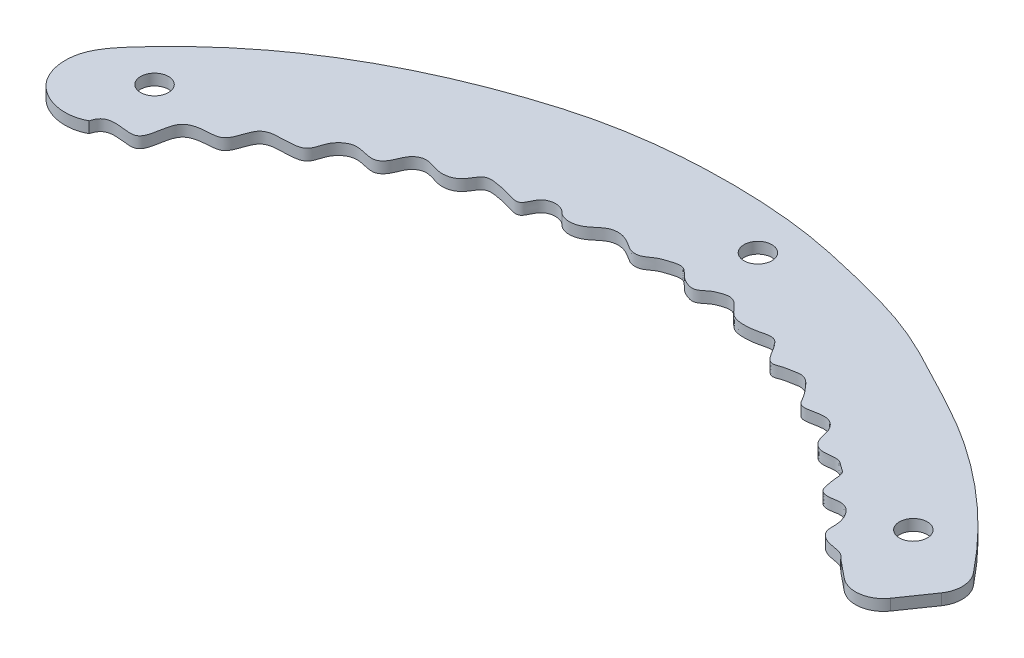
from build123d import *

# Parameters (mm, degrees)
SKETCH_1_R      = 1.5
EXTRUDE_1_DEPTH = 1.2


with BuildPart() as part:
    # 草图1 → 凸台-拉伸1 (new body)
    with BuildSketch(Plane(origin=(0, 0, 0), x_dir=(1, 0, 0), z_dir=(0, 1, 0))):
        with BuildLine():
            Line((1.554842025, -8.337470752), (-0.430182488, -6.721253648))
            add(Edge.make_bspline(
                [(-12.167013089, 2.582495486), (-11.447119164, 1.921340953), (-10.022984841, 2.808187734), (-8.976354657, 1.809108801), (-8.213499094, 1.403974471), (-8.200391236, 0.349911537), (-8.042555918, -0.493978579), (-7.818959944, -1.429413296), (-6.816890722, -1.753533483), (-5.863601288, -1.34252738), (-4.741281829, -1.710962858), (-4.08275959, -2.621388779), (-3.79245167, -3.751248723), (-3.91045161, -4.869308905), (-3.232112336, -5.62677615), (-2.206661316, -6.030432082), (-1.046114317, -6.062557348), (-0.554897819, -6.564537203), (-0.430182488, -6.721253648)],
                knots=[0, 0, 0, 0, 0.036097754, 0.047992692, 0.058181774, 0.069734768, 0.087708592, 0.096698401, 0.107023851, 0.126400839, 0.138602891, 0.153227265, 0.171393147, 0.187122158, 0.197485969, 0.211171774, 0.233173167, 0.241577569, 0.241577569, 0.241577569, 0.241577569], degree=3))
            add(Edge.make_bspline(
                [(-23.910622578, 9.605703978), (-23.558251314, 9.383041776), (-22.85001025, 7.300114936), (-21.469099437, 8.026620732), (-20.587576459, 8.115237732), (-19.709548371, 8.393102022), (-18.887373608, 8.016971733), (-18.216370279, 7.270572104), (-17.540916668, 6.495384207), (-16.917331111, 5.169819241), (-15.366310155, 5.588705202), (-13.906745135, 5.747852304), (-12.700950999, 4.350101993), (-12.869807319, 3.109436312), (-12.167013089, 2.582495486)],
                knots=[0, 0, 0, 0, 0.161236225, 0.212348344, 0.265446348, 0.336192936, 0.378687986, 0.430636784, 0.526782428, 0.58317029, 0.682556587, 0.781270878, 0.853713789, 1, 1, 1, 1], degree=3))
            add(Edge.make_bspline(
                [(-47.71500508, 10.605110168), (-47.069012481, 9.900665068), (-45.139196949, 9.95795741), (-43.921975491, 11.586374146), (-42.400721003, 11.771016568), (-41.337482007, 11.307681084), (-40.40808197, 10.571392493), (-39.243263098, 10.605948191), (-38.4214004, 11.389817674), (-37.304125392, 11.739033216), (-35.960015429, 12.177678326), (-35.169730239, 11.095889884), (-34.309116257, 10.597574945), (-33.230198284, 10.326758803), (-32.483614479, 11.172498611), (-31.555931442, 11.556931314), (-30.496219104, 11.833170836), (-29.544579211, 11.011421042), (-28.764862011, 9.931048883), (-27.275040054, 9.791587696), (-25.67786866, 9.995507673), (-24.429632089, 10.493743868), (-23.910622578, 9.605703978)],
                knots=[0, 0, 0, 0, 0.101433113, 0.182304189, 0.213922123, 0.268056796, 0.309965909, 0.34593792, 0.389140378, 0.432998877, 0.482664358, 0.529097115, 0.56671955, 0.598853252, 0.644172777, 0.680167064, 0.715860802, 0.759457234, 0.81099574, 0.863337515, 0.916048189, 1, 1, 1, 1], degree=3))
            add(Edge.make_bspline(
                [(-81.542178077, -6.351268144), (-81.044844843, -4.213625321), (-76.423345521, -7.044199198), (-77.193888837, -1.434611804), (-74.499558051, -1.007137962), (-72.119579546, -0.982023336), (-72.013913214, 2.531930358), (-69.193446107, 2.27076818), (-66.979018583, 2.576834428), (-66.793337265, 4.561491582), (-65.228171966, 5.86647802), (-63.704347585, 5.431207109), (-62.480661462, 5.233397848), (-61.483715157, 6.199125284), (-61.300552849, 7.503159562), (-59.783145719, 8.397586745), (-58.519758063, 7.703062295), (-57.095970203, 7.658840879), (-55.836025853, 8.294649296), (-55.32460036, 9.901269354), (-53.585326171, 9.702085323), (-52.400209447, 9.422945796), (-50.584393612, 8.813116301), (-50.168047343, 11.113872633), (-48.335164825, 11.166138113), (-47.71500508, 10.605110168)],
                knots=[0, 0, 0, 0, 0.100331873, 0.186040252, 0.234954161, 0.270300487, 0.337741822, 0.40191981, 0.438279808, 0.476829941, 0.523229195, 0.559516768, 0.58417291, 0.604077361, 0.648703103, 0.670042471, 0.715950186, 0.738312734, 0.768610762, 0.808997733, 0.834826144, 0.87587524, 0.906400305, 0.9417144, 1, 1, 1, 1], degree=3))
            add(Edge.make_bspline(
                [(-4.574887638, 10.66290641), (-7.047776333, 12.318799851), (-11.472376922, 14.618164059), (-18.644622628, 18.44627649), (-25.552826118, 20.285346034), (-32.311147255, 21.765124491), (-38.45622276, 22.334485332), (-46.036730806, 22.337974028), (-53.580560852, 21.321427277), (-60.391912278, 19.259553222), (-67.916492846, 16.400566872), (-77.044091587, 11.490220125), (-84.229889169, 5.096115142), (-88.471829307, 0.104808879), (-88.546333927, -3.099341055), (-86.895953255, -6.534699066), (-83.496346554, -7.409474397), (-81.542178077, -6.351268144)],
                knots=[0.083499365, 0.083499365, 0.083499365, 0.083499365, 0.162308773, 0.214040795, 0.297345888, 0.349154488, 0.396314503, 0.459530434, 0.548645129, 0.595484357, 0.646703325, 0.76081959, 0.864658636, 0.902713076, 0.926128156, 0.944546812, 1, 1, 1, 1], degree=3))
            ThreePointArc((-4.574887638, 10.66290641), (2.168791448, 5.355026647), (8.021297782, -0.921832822))
            ThreePointArc((8.021297782, -0.921832822), (8.67491192, -2.691224286), (8.143227785, -4.500994872))
            Line((8.143227785, -4.500994872), (5.915584874, -7.718701298))
            ThreePointArc((5.915584874, -7.718701298), (3.870472767, -8.981318439), (1.554842025, -8.337470752))
        make_face()
        with Locations(Location((-81.41369729, 0.541251493, 0), (0, 0, 270))):
            Circle(SKETCH_1_R, mode=Mode.SUBTRACT)
        with Locations(Location((0.783039877, -0.136157483, 0), (0, 0, 270))):
            Circle(SKETCH_1_R, mode=Mode.SUBTRACT)
        with Locations(Location((-33.354785226, 17.302208681, 0), (0, 0, 270))):
            Circle(SKETCH_1_R, mode=Mode.SUBTRACT)
    extrude(amount=EXTRUDE_1_DEPTH)


solid = part.part
